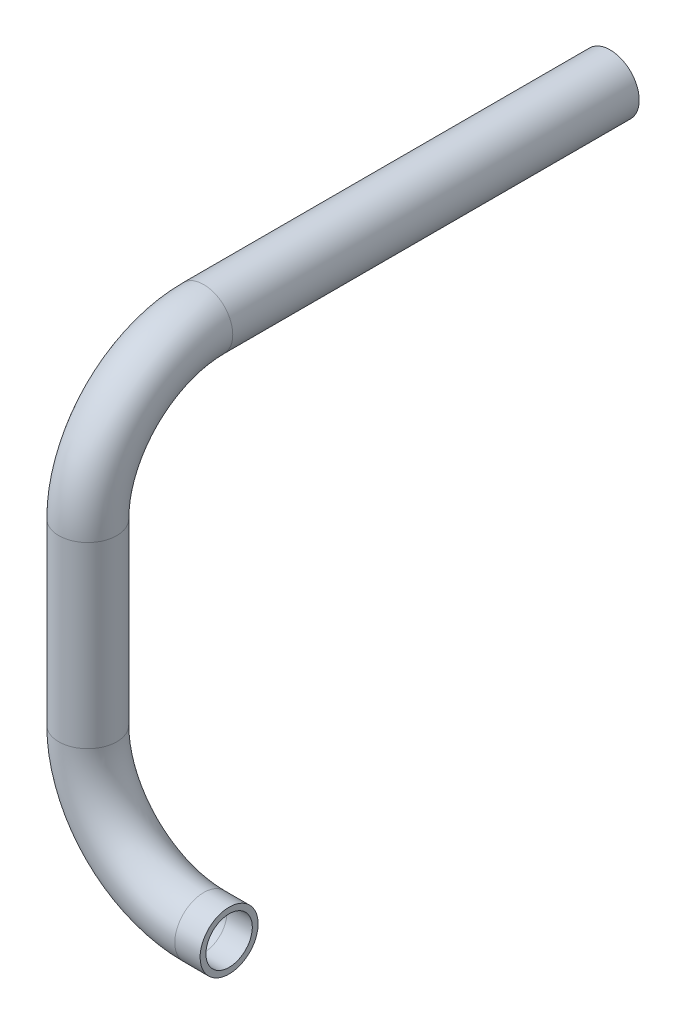
from build123d import *

# Parameters (mm, degrees)
SKETCH1_R   = 6.35
SKETCH1_R_2 = 5.08


with BuildPart() as part:
    # Sweep1: sweep along a curve in space
    with BuildLine() as sweep1_path:
        Line((-267.546047561, 126.276355941, 20.559623431), (-267.546047561, 126.276355941, 109.564142662))
        ThreePointArc((-267.546047561, 100.876355941, 134.964142662), (-267.546047561, 118.836868183, 127.524654904), (-267.546047561, 126.276355941, 109.564142662))
        Line((-267.546047561, 100.876355941, 134.964142662), (-267.546047561, 61.776355941, 134.964142662))
        ThreePointArc((-242.146047561, 36.376355941, 134.964142662), (-260.106559803, 43.815843699, 134.964142662), (-267.546047561, 61.776355941, 134.964142662))
        Line((-236.593594298, 36.376355941, 134.964142662), (-242.146047561, 36.376355941, 134.964142662))
    # Sketch1 → Sweep1 (sweep)
    with BuildSketch(Plane(origin=(-267.546047561, 126.276355941, 20.559623431), x_dir=(1, 0, 0), z_dir=(0, 0, 1))):
        Circle(SKETCH1_R)
        Circle(SKETCH1_R_2, mode=Mode.SUBTRACT)
    sweep(path=sweep1_path.line)


solid = part.part
